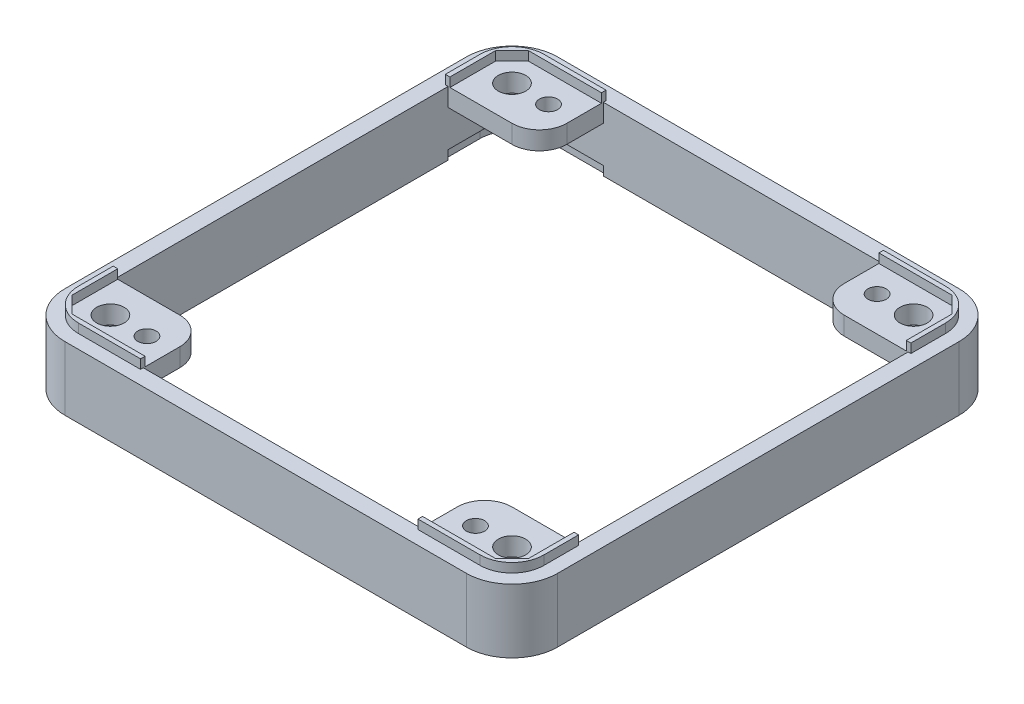
from build123d import *

# Parameters (mm, degrees)
EXTRUDE_2_DEPTH     = 7
EXTRUDE_START       = -2
EXTRUDE_3_DEPTH     = 2
EXTRUDE_4_DEPTH     = 1
SKETCH_11_R         = 1.5
SKETCH_11_R_2       = 1
CUT_EXTRUDE_2_DEPTH = 2
CUT_EXTRUDE_3_DEPTH = 1


with BuildPart() as part:
    # ｽｹｯﾁ7 → ﾎﾞｽ - 押し出し2 (new body)
    with BuildSketch(Plane(origin=(0, 0, 0), x_dir=(1, 0, 0), z_dir=(0, 1, 0))):
        with BuildLine():
            Line((22, 25.2), (0, 25.2))
            Line((0, 25.2), (0, 27))
            Line((0, 27), (22, 27))
            ThreePointArc((22, 27), (25.535533906, 25.535533906), (27, 22))
            Line((27, 22), (27, 0))
            Line((27, 0), (25.2, 0))
            Line((25.2, 0), (25.2, 22))
            ThreePointArc((25.2, 22), (24.2627417, 24.2627417), (22, 25.2))
        make_face()
    extrude(amount=EXTRUDE_2_DEPTH)

    # ｽｹｯﾁ8 → ﾎﾞｽ - 押し出し3 (add)
    with BuildSketch(Plane(origin=(0, 7, 0), x_dir=(1, 0, 0), z_dir=(0, 1, 0)).offset(EXTRUDE_START)):
        with BuildLine():
            Line((15.2, 21.2), (15.2, 25.2))
            Line((15.2, 25.2), (22, 25.2))
            ThreePointArc((22, 25.2), (24.2627417, 24.2627417), (25.2, 22))
            Line((25.2, 22), (25.2, 18.2))
            Line((25.2, 18.2), (18.2, 18.2))
            ThreePointArc((18.2, 18.2), (16.078679656, 19.078679656), (15.2, 21.2))
        make_face()
    extrude(amount=EXTRUDE_3_DEPTH)

    # ｽｹｯﾁ10 → ﾎﾞｽ - 押し出し4 (add)
    with BuildSketch(Plane(origin=(0, 7, 0), x_dir=(1, 0, 0), z_dir=(0, 1, 0))):
        with BuildLine():
            Line((25, 23.2), (25, 18.2))
            Line((25, 18.2), (25.5, 18.2))
            Line((25.5, 18.2), (25.5, 22))
            ThreePointArc((25.5, 22), (24.474873734, 24.474873734), (22, 25.5))
            Line((22, 25.5), (15.2, 25.5))
            Line((15.2, 25.5), (15.2, 25))
            Line((15.2, 25), (23.2, 25))
            Line((23.2, 25), (25, 23.2))
        make_face()
    extrude(amount=EXTRUDE_4_DEPTH)

    # ｽｹｯﾁ11 → ｶｯﾄ - 押し出し2 (cut)
    with BuildSketch(Plane(origin=(0, 7, 0), x_dir=(1, 0, 0), z_dir=(0, 1, 0))):
        with Locations(Location((22, 22, 0), (0, 0, 270))):
            Circle(SKETCH_11_R)
        with Locations(Location((18, 22, 0), (0, 0, 270))):
            Circle(SKETCH_11_R_2)
    extrude(amount=-CUT_EXTRUDE_2_DEPTH, mode=Mode.SUBTRACT)

    # ｽｹｯﾁ12 → ｶｯﾄ - 押し出し3 (cut)
    with BuildSketch(Plane(origin=(0, 0, 0), x_dir=(-1, 0, 0), z_dir=(0, -1, 0))):
        with BuildLine():
            Line((-22, 25), (-15.2, 25))
            Line((-15.2, 25), (-15.2, 25.5))
            Line((-15.2, 25.5), (-22, 25.5))
            ThreePointArc((-22, 25.5), (-24.474873734, 24.474873734), (-25.5, 22))
            Line((-25.5, 22), (-25.5, 18.2))
            Line((-25.5, 18.2), (-25, 18.2))
            Line((-25, 18.2), (-25, 22))
            ThreePointArc((-25, 22), (-24.121320344, 24.121320344), (-22, 25))
        make_face()
    extrude(amount=-CUT_EXTRUDE_3_DEPTH, mode=Mode.SUBTRACT)

    # ﾐﾗｰ1: part across plane


with BuildPart() as part_1:
    add(part.part)
    add(part.part.mirror(Plane(origin=(0, 0, 0), x_dir=(0, 0, 1), z_dir=(1, 0, 0))))

    # ﾐﾗｰ2: part across plane


with BuildPart() as part_2:
    add(part_1.part)
    add(part_1.part.mirror(Plane.XY))


solid = part_2.part
